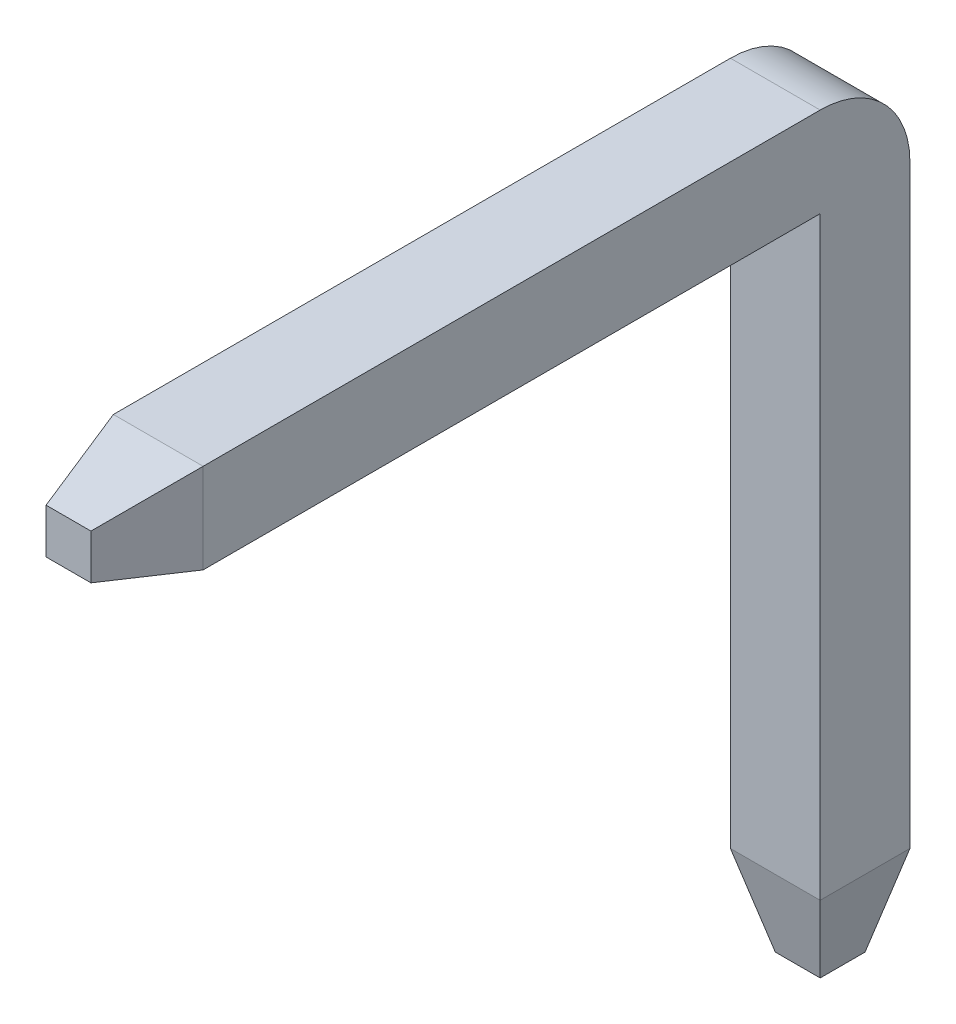
from build123d import *

# Parameters (mm, degrees)
SKETCH_1_W      = 6.9
SKETCH_1_H      = 0.8
EXTRUDE_1_DEPTH = 0.8
SKETCH_2_W      = 0.8
SKETCH_2_H      = 0.8
EXTRUDE_2_DEPTH = 6.3
CHAMFER_1_SIZE  = 0.2
CHAMFER_1_SIZE2 = 0.8
CHAMFER_2_SIZE  = 0.2
CHAMFER_2_SIZE2 = 0.8
FILLET_1_R      = 0.8


with BuildPart() as part:
    # Эскиз1 → Бобышка-Вытянуть1 (new body)
    with BuildSketch(Plane(origin=(-0.4, 0, 0), x_dir=(0, -1, 0), z_dir=(-1, 0, 0))):
        with Locations((-0.4, -3.55)):
            Rectangle(SKETCH_1_W, SKETCH_1_H)
    extrude(amount=-EXTRUDE_1_DEPTH)

    # Эскиз2 → Бобышка-Вытянуть2 (add)
    with BuildSketch(Plane.XY.offset(-3.15)):
        with Locations((0, 3.45)):
            Rectangle(SKETCH_2_W, SKETCH_2_H)
    extrude(amount=EXTRUDE_2_DEPTH)

    # Фаска1
    chamfer_1_edges = [part.edges().sort_by_distance(p)[0] for p in [
        (0, -3.05, -3.15),
        (0.4, -3.05, -3.55),
        (-0.4, -3.05, -3.55),
        (0, -3.05, -3.95),
    ]]
    chamfer_1_side = [part.faces().sort_by_distance(p)[0] for p in [
        (0, -3.05, -3.55),
    ]]
    chamfer(chamfer_1_edges, length=CHAMFER_1_SIZE, length2=CHAMFER_1_SIZE2, reference=chamfer_1_side[0])

    # Фаска2
    chamfer_2_edges = [part.edges().sort_by_distance(p)[0] for p in [
        (0, 3.85, 3.15),
        (0.4, 3.45, 3.15),
        (-0.4, 3.45, 3.15),
        (0, 3.05, 3.15),
    ]]
    chamfer_2_side = [part.faces().sort_by_distance(p)[0] for p in [
        (0, 3.45, 3.15),
    ]]
    chamfer(chamfer_2_edges, length=CHAMFER_2_SIZE, length2=CHAMFER_2_SIZE2, reference=chamfer_2_side[0])

    # Скругление1
    fillet_1_edges = [part.edges().sort_by_distance(p)[0] for p in [
        (0, 3.85, -3.95),
    ]]
    fillet(fillet_1_edges, radius=FILLET_1_R)


solid = part.part
